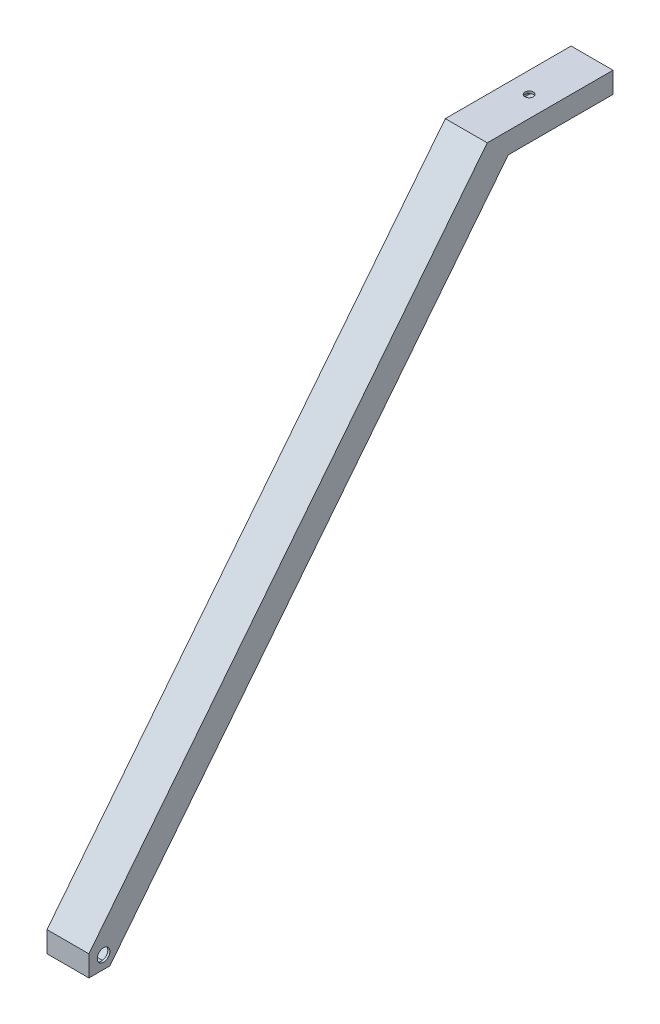
from build123d import *

# Parameters (mm, degrees)
Y_KSEKLIK_EKSTR_ZYON1_DEPTH = 10
BO_ALTMA1_T                 = -1
IZIM2_R                     = 2
KES_EKSTR_ZYON1_DEPTH       = 27
IZIM3_R                     = 3
KES_EKSTR_ZYON2_DEPTH       = 37


with BuildPart() as part:
    # Çizim1 → Yükseklik-Ekstrüzyon1 (new, symmetric)
    with BuildSketch(Plane(origin=(0, 0, 0), x_dir=(0, 0, -1), z_dir=(1, 0, 0))):
        Polygon((0, 0), (-50, 0), (-240, -240), (-250, -240), (-250, -230), (-60, 10), (0, 10), align=None)
    extrude(amount=Y_KSEKLIK_EKSTR_ZYON1_DEPTH, both=True)

    # İç Boşaltma1
    bo_altma1_openings = [part.faces().sort_by_distance(p)[0] for p in [
        (0, 5, 0),
    ]]
    offset(amount=BO_ALTMA1_T, openings=bo_altma1_openings, kind=Kind.INTERSECTION)

    # Çizim2 → Kes-Ekstrüzyon1 (cut)
    with BuildSketch(Plane(origin=(0, 10, 0), x_dir=(1, 0, 0), z_dir=(0, 1, 0))):
        with Locations(Location((0, -30, 0), (0, 0, 270))):
            Circle(IZIM2_R)
    extrude(amount=-KES_EKSTR_ZYON1_DEPTH, mode=Mode.SUBTRACT)

    # Çizim3 → Kes-Ekstrüzyon2 (cut)
    with BuildSketch(Plane.ZY.offset(10)):
        with Locations((243, -234)):
            Circle(IZIM3_R)
    extrude(amount=-KES_EKSTR_ZYON2_DEPTH, mode=Mode.SUBTRACT)


solid = part.part
